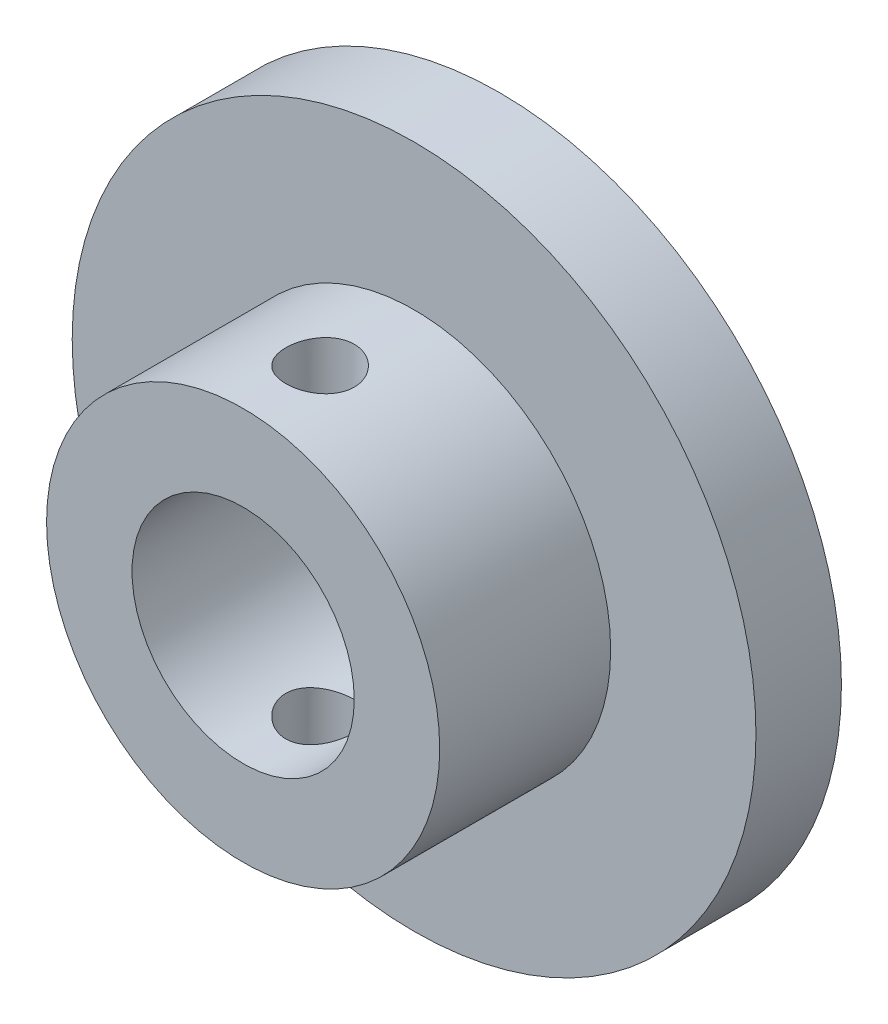
from build123d import *

# Parameters (mm, degrees)
CROQUIS1_R              = 20
CROQUIS1_R_2            = 6.5
SALIENTE_EXTRUIR1_DEPTH = 2.5
CROQUIS2_R              = 11.5
CROQUIS2_R_2            = 6.5
SALIENTE_EXTRUIR2_DEPTH = 10
CROQUIS3_R              = 2
CORTAR_EXTRUIR1_DEPTH   = 15


with BuildPart() as part:
    # Croquis1 → Saliente-Extruir1 (new, symmetric)
    with BuildSketch(Plane.XY):
        Circle(CROQUIS1_R)
        Circle(CROQUIS1_R_2, mode=Mode.SUBTRACT)
    extrude(amount=SALIENTE_EXTRUIR1_DEPTH, both=True)

    # Croquis2 → Saliente-Extruir2 (add)
    with BuildSketch(Plane.XY.offset(2.5)):
        Circle(CROQUIS2_R)
        Circle(CROQUIS2_R_2, mode=Mode.SUBTRACT)
    extrude(amount=SALIENTE_EXTRUIR2_DEPTH)

    # Croquis3 → Cortar-Extruir1 (cut, symmetric)
    with BuildSketch(Plane(origin=(0, 0, 0), x_dir=(1, 0, 0), z_dir=(0, 1, 0))):
        with Locations(Location((0, -8, 0), (0, 0, 270))):
            Circle(CROQUIS3_R)
    extrude(amount=CORTAR_EXTRUIR1_DEPTH, both=True, mode=Mode.SUBTRACT)


solid = part.part
